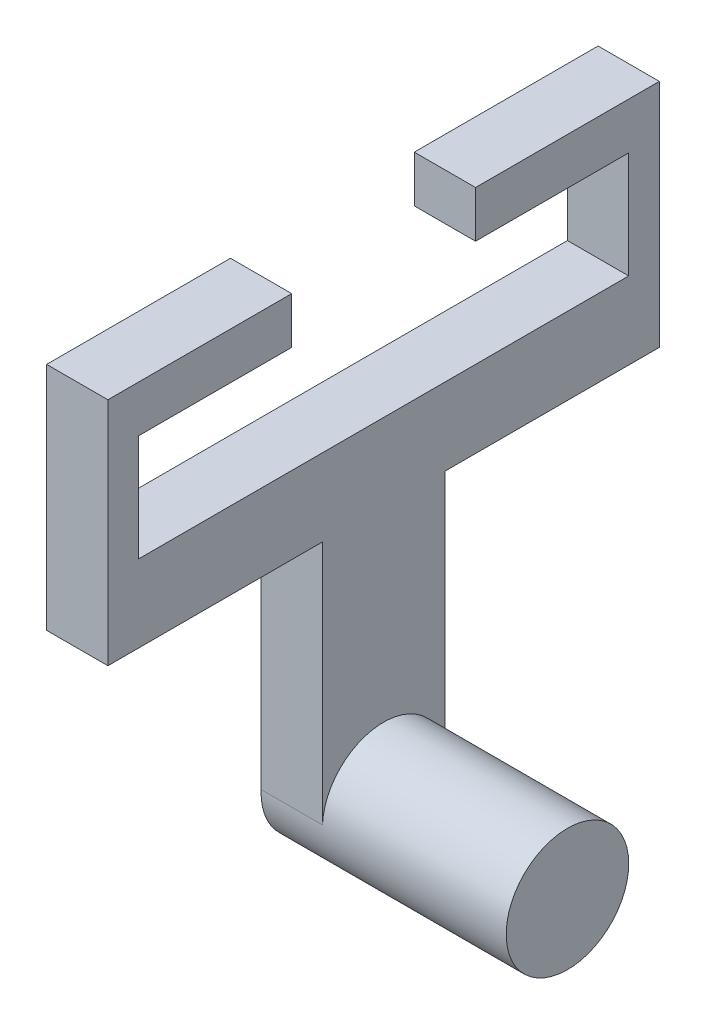
from build123d import *

# Parameters (mm, degrees)
SKETCH2_R           = 12.7
BOSS_EXTRUDE1_DEPTH = 50.8
SKETCH3_W           = 25.4
SKETCH3_H           = 50.8
BOSS_EXTRUDE2_DEPTH = 12.7
SKETCH5_W           = 101.6
SKETCH5_H           = 16.002
BOSS_EXTRUDE3_DEPTH = 12.7
SKETCH6_W           = 6.35
SKETCH6_H           = 38.1
BOSS_EXTRUDE4_DEPTH = 12.7
SKETCH7_W           = 38.1
SKETCH7_H           = 9.652
BOSS_EXTRUDE5_DEPTH = 12.7


with BuildPart() as part:
    # Sketch2 → Boss-Extrude1 (new body)
    with BuildSketch(Plane(origin=(0, 0, 0), x_dir=(0, 0, -1), z_dir=(1, 0, 0))):
        Circle(SKETCH2_R)
    extrude(amount=BOSS_EXTRUDE1_DEPTH)

    # Sketch3 → Boss-Extrude2 (add)
    with BuildSketch(Plane.ZY):
        with Locations((0.014597196, 26.008732875)):
            Rectangle(SKETCH3_W, SKETCH3_H)
    extrude(amount=-BOSS_EXTRUDE2_DEPTH)


with BuildPart() as body_2:
    # Sketch5 → Boss-Extrude3 (new body)
    with BuildSketch(Plane(origin=(0, 0, 0), x_dir=(0, 0, -1), z_dir=(1, 0, 0))):
        with Locations((0, 59.392294155)):
            Rectangle(SKETCH5_W, SKETCH5_H)
    extrude(amount=BOSS_EXTRUDE3_DEPTH)

    # Sketch6 → Boss-Extrude4 (add)
    with BuildSketch(Plane(origin=(0, 0, 0), x_dir=(0, 0, -1), z_dir=(1, 0, 0))):
        with Locations((-53.975, 70.441294155)):
            Rectangle(SKETCH6_W, SKETCH6_H)
        with Locations((53.975, 70.441294155)):
            Rectangle(SKETCH6_W, SKETCH6_H)
    extrude(amount=BOSS_EXTRUDE4_DEPTH)

    # Sketch7 → Boss-Extrude5 (add)
    with BuildSketch(Plane(origin=(0, 0, 0), x_dir=(0, 0, -1), z_dir=(1, 0, 0))):
        with Locations((-38.1, 94.317294155)):
            Rectangle(SKETCH7_W, SKETCH7_H)
        with Locations((38.1, 94.317294155)):
            Rectangle(SKETCH7_W, SKETCH7_H)
    extrude(amount=BOSS_EXTRUDE5_DEPTH)


with BuildPart() as part_1:
    add(part.part)

    # Combine1: union body 2
    add(body_2.part)


solid = part_1.part
